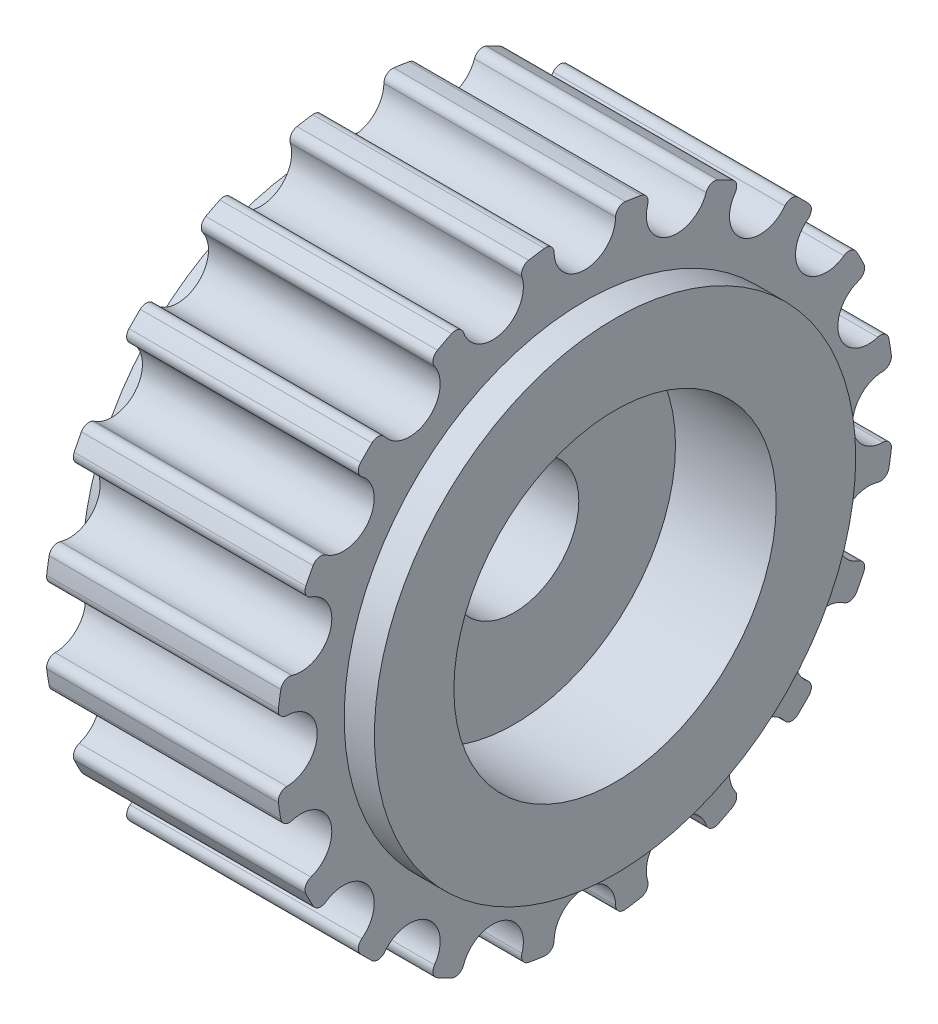
from build123d import *

# Parameters (mm, degrees)
BOSS_EXTRUDE1_DEPTH = 5.75
CIRPATTERN1_COUNT   = 20
SKETCH2_R           = 11.945
BOSS_EXTRUDE2_DEPTH = 1.5
SKETCH4_R           = 8
CUT_EXTRUDE2_DEPTH  = 5
SKETCH3_R           = 3.2
CUT_EXTRUDE1_DEPTH  = 14.5


with BuildPart() as part:
    # Sketch1 → Boss-Extrude1 (new, symmetric)
    with BuildSketch(Plane(origin=(0, 0, 0), x_dir=(0, 0, -1), z_dir=(1, 0, 0))):
        with BuildLine():
            Line((0, 13.285), (0, 0))
            Line((0, 0), (4.10529077, 12.634785819))
            ThreePointArc((4.10529077, 12.634785819), (3.221971668, 13.384600745), (3.120582785, 14.538808418))
            ThreePointArc((3.120582785, 14.538808418), (3.07819699, 14.888914891), (2.788180956, 15.089568316))
            ThreePointArc((2.788180956, 15.089568316), (2.400486866, 15.156077586), (2.011215381, 15.212627574))
            ThreePointArc((2.011215381, 15.212627574), (1.673388423, 15.111414709), (1.524888287, 14.791541599))
            ThreePointArc((1.524888287, 14.791541599), (1.071791943, 13.725155757), (0, 13.285))
        make_face()
    boss_extrude1 = extrude(amount=BOSS_EXTRUDE1_DEPTH, both=True)

    # CirPattern1: Boss-Extrude1 ×20 about axis
    cirpattern1_axis = Axis((0, 0, 0), (1, 0, 0))
    for i in range(1, CIRPATTERN1_COUNT):
        add(boss_extrude1.rotate(cirpattern1_axis, i * 360 / CIRPATTERN1_COUNT))

    # Sketch2 → Boss-Extrude2 (add)
    with BuildSketch(Plane(origin=(5.75, 0, 0), x_dir=(0, 0, -1), z_dir=(1, 0, 0))):
        Circle(SKETCH2_R)
    boss_extrude2 = extrude(amount=BOSS_EXTRUDE2_DEPTH)

    # Sketch4 → Cut-Extrude2 (cut)
    with BuildSketch(Plane(origin=(7.25, 0, 0), x_dir=(0, 0, -1), z_dir=(1, 0, 0))):
        Circle(SKETCH4_R)
    cut_extrude2 = extrude(amount=-CUT_EXTRUDE2_DEPTH, mode=Mode.SUBTRACT)

    # Mirror1: Boss-Extrude2, Cut-Extrude2 across plane
    add(boss_extrude2.mirror(Plane(origin=(0, 0, 0), x_dir=(0, 0, 1), z_dir=(1, 0, 0))))
    add(cut_extrude2.mirror(Plane(origin=(0, 0, 0), x_dir=(0, 0, 1), z_dir=(1, 0, 0))), mode=Mode.SUBTRACT)

    # Sketch3 → Cut-Extrude1 (cut)
    with BuildSketch(Plane(origin=(7.25, 0, 0), x_dir=(0, 0, -1), z_dir=(1, 0, 0))):
        Circle(SKETCH3_R)
    extrude(amount=-CUT_EXTRUDE1_DEPTH, mode=Mode.SUBTRACT)


solid = part.part
